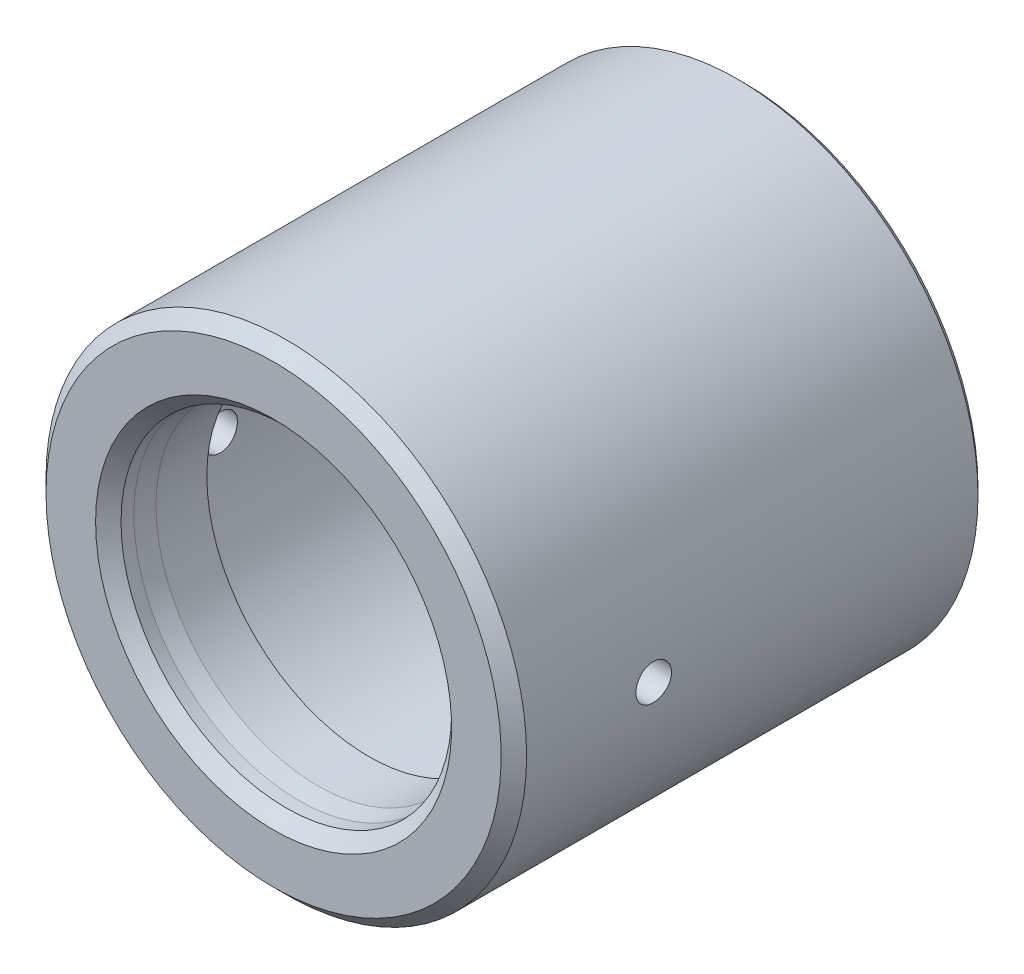
from build123d import *

# Parameters (mm, degrees)
SKETCH_2_R               = 2.4
CUT_EXTRUDE_1_DEPTH      = 46.644495835
CHAMFER_1_SIZE           = 0.5
CHAMFER_2_SIZE           = 1
CUT_EXTRUDE_2_DEPTH      = 46.644495918
CUT_EXTRUDE_2_DEPTH_BACK = 46.644495918
SKETCH_3_R               = 1.4


with BuildPart() as part:
    # 스케치1 → 회전1 (revolve)
    with BuildSketch(Plane(origin=(0, 0, 0), x_dir=(0, 0, -1), z_dir=(1, 0, 0)), mode=Mode.PRIVATE) as revolve_1_sk:
        with BuildLine():
            Line((0, 13), (2, 13))
            Line((2, 13), (3.5, 12.75))
            Line((3.5, 12.75), (7.5, 12.75))
            ThreePointArc((7.5, 12.75), (8.019590324, 14.137023112), (8.996877215, 15.25))
            Line((8.996877215, 15.25), (37, 15.25))
            Line((37, 15.25), (37, 18.9))
            Line((37, 18.9), (0, 18.9))
            Line((0, 18.9), (0, 13))
        make_face()
    revolve(revolve_1_sk.sketch.rotate(Axis((0, 0, 0), (0, 0, -1)), 90), axis=Axis((0, 0, 0), (0, 0, -1)))

    # 스케치2 → 컷-돌출1 (cut, through all)
    with BuildSketch(Plane(origin=(0, 0, 0), x_dir=(1, 0, 0), z_dir=(0, 1, 0))):
        with Locations(Location((0, 25, 0), (0, 0, 270))):
            Circle(SKETCH_2_R)
    extrude(amount=-CUT_EXTRUDE_1_DEPTH, mode=Mode.SUBTRACT)

    # 모따기1
    chamfer_1_edges = [part.edges().sort_by_distance(p)[0] for p in [
        (-18.9, 0, -37),
    ]]
    chamfer(chamfer_1_edges, length=CHAMFER_1_SIZE)

    # 모따기2
    chamfer_2_edges = [part.edges().sort_by_distance(p)[0] for p in [
        (-18.9, 0, 0),
        (-15.25, 0, -37),
        (-13, 0, 0),
    ]]
    chamfer(chamfer_2_edges, length=CHAMFER_2_SIZE)

    # 스케치3 → 컷-돌출2 (cut, two sides: drawn at the far end of the back side and taken through both)
    with BuildSketch(Plane(origin=(0, 0, 0), x_dir=(0, 0, -1), z_dir=(1, 0, 0)).offset(-CUT_EXTRUDE_2_DEPTH_BACK)):
        with Locations((11, 0)):
            Circle(SKETCH_3_R)
    extrude(amount=CUT_EXTRUDE_2_DEPTH + CUT_EXTRUDE_2_DEPTH_BACK, mode=Mode.SUBTRACT)


solid = part.part
